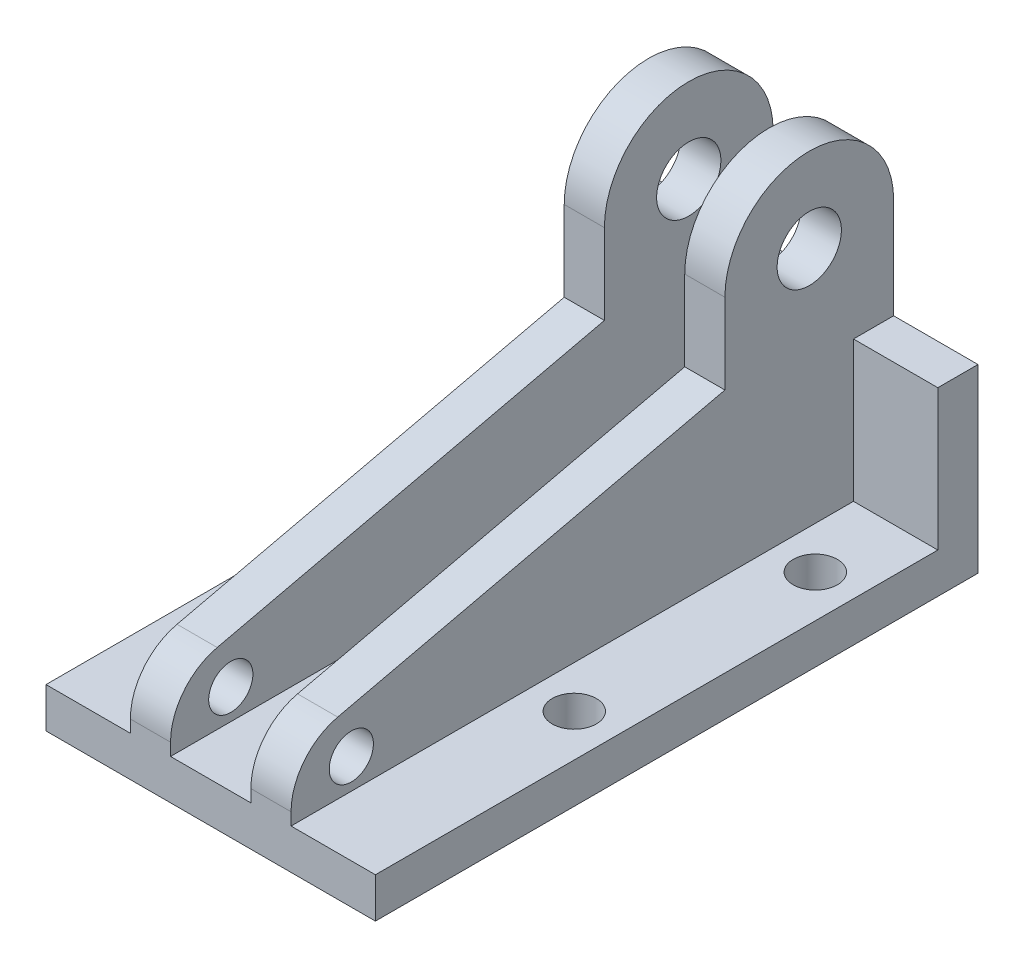
from build123d import *

# Parameters (mm, degrees)
BOSS_EXTRUDE1_DEPTH = 41
SKETCH2_R           = 8
SKETCH2_R_2         = 5.5
BOSS_EXTRUDE2_DEPTH = 10
SKETCH3_R           = 5.5
CUT_EXTRUDE1_DEPTH  = 10
FILLET1_R           = 15


with BuildPart() as part:
    # Sketch1 → Boss-Extrude1 (new, symmetric)
    with BuildSketch(Plane(origin=(0, 0, 0), x_dir=(0, 0, -1), z_dir=(1, 0, 0))):
        Polygon((0, 0), (-10, 0), (-10, -35), (-150, -35), (-150, -45), (0, -45), align=None)
    extrude(amount=BOSS_EXTRUDE1_DEPTH, both=True)

    # Sketch2 → Boss-Extrude2 (add)
    with BuildSketch(Plane(origin=(10, 0, 0), x_dir=(0, 0, -1), z_dir=(1, 0, 0))):
        with BuildLine():
            Line((-150, -35), (-150, -20))
            Line((-150, -20), (-42, 5))
            Line((-42, 5), (-42, 25))
            ThreePointArc((-42, 25), (-21, 46), (0, 25))
            Line((0, 25), (0, 0))
            Line((0, 0), (-10, 0))
            Line((-10, 0), (-10, -35))
            Line((-10, -35), (-150, -35))
        make_face()
        with Locations((-21, 25)):
            Circle(SKETCH2_R, mode=Mode.SUBTRACT)
        with Locations((-135, -27.5)):
            Circle(SKETCH2_R_2, mode=Mode.SUBTRACT)
    boss_extrude2 = extrude(amount=BOSS_EXTRUDE2_DEPTH)

    # Mirror1: Boss-Extrude2 across plane
    add(boss_extrude2.mirror(Plane(origin=(0, 0, 0), x_dir=(0, 0, 1), z_dir=(1, 0, 0))))

    # Sketch3 → Cut-Extrude1 (cut)
    with BuildSketch(Plane(origin=(0, -35, 0), x_dir=(1, 0, 0), z_dir=(0, 1, 0))):
        with Locations(Location((30.5, -30, 0), (0, 0, 270))):
            Circle(SKETCH3_R)
        with Locations(Location((30.5, -90, 0), (0, 0, 270))):
            Circle(SKETCH3_R)
        with Locations(Location((-30.5, -90, 0), (0, 0, 270))):
            Circle(SKETCH3_R)
        with Locations(Location((-30.5, -30, 0), (0, 0, 270))):
            Circle(SKETCH3_R)
    extrude(amount=-CUT_EXTRUDE1_DEPTH, mode=Mode.SUBTRACT)

    # Fillet1
    fillet1_edges = [part.edges().sort_by_distance(p)[0] for p in [
        (15, -20, 150),
        (-15, -20, 150),
    ]]
    fillet(fillet1_edges, radius=FILLET1_R)


solid = part.part
